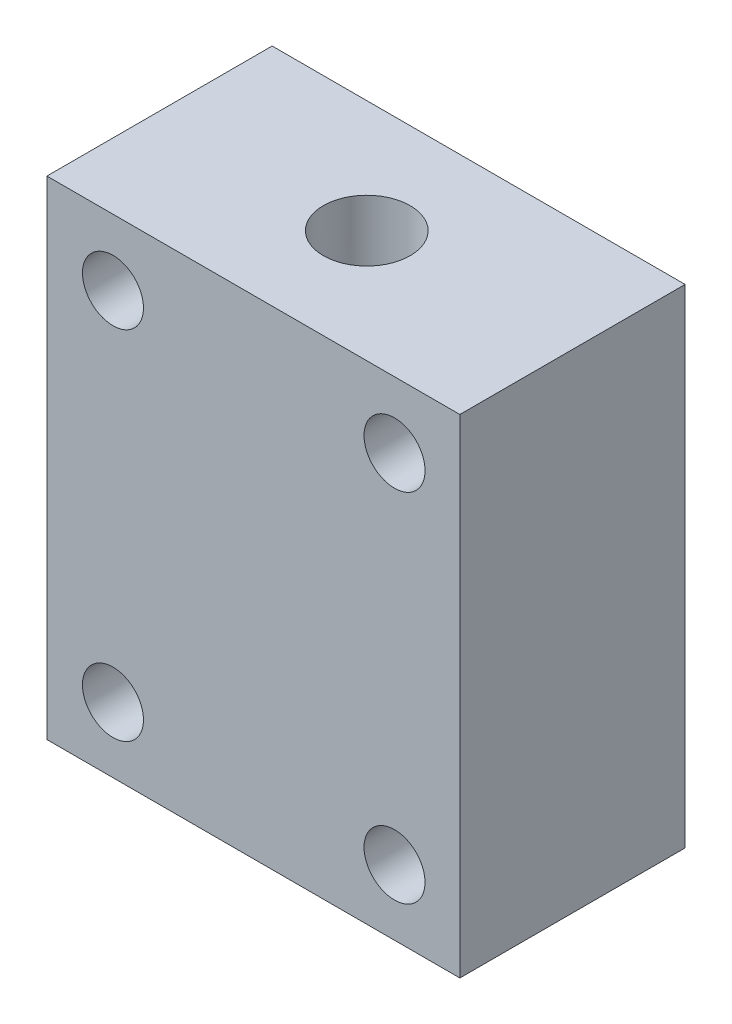
from build123d import *

# Parameters (mm, degrees)
SKETCH1_W                   = 82.55
SKETCH1_H                   = 69.85
BOSS_EXTRUDE1_DEPTH         = 19.05
F_3_8_CLEARANCE_HOLE1_D     = 10.31875
F_3_8_CLEARANCE_HOLE1_DEPTH = 38.1
F_3_8_CLEARANCE_HOLE1_TIP   = 3.100065256
F_3_8_CLEARANCE_HOLE2_D     = 10.31875
F_3_8_CLEARANCE_HOLE2_DEPTH = 38.1
F_3_8_CLEARANCE_HOLE2_TIP   = 3.100065256
CUT_EXTRUDE2_START          = -19.05
SKETCH6_R                   = 7.3421875
CUT_EXTRUDE2_DEPTH          = 28.448
CUT_EXTRUDE4_START          = -19.05
SKETCH7_R                   = 12.7254
CUT_EXTRUDE4_DEPTH          = 2.8194
CUT_EXTRUDE6_START          = -19.05
SKETCH8_R                   = 7.3421875
CUT_EXTRUDE6_DEPTH          = 28.448
CUT_EXTRUDE8_START          = -19.05
SKETCH9_R                   = 12.7254
CUT_EXTRUDE8_DEPTH          = 2.8194
CUT_EXTRUDE10_START         = 41.275
SKETCH10_R                  = 7.3421875
CUT_EXTRUDE10_DEPTH         = 60.452


with BuildPart() as part:
    # Sketch1 → Boss-Extrude1 (new, symmetric)
    with BuildSketch(Plane(origin=(0, 0, 0), x_dir=(0, 1, 0), z_dir=(0, 0, 1))):
        Rectangle(SKETCH1_W, SKETCH1_H)
    extrude(amount=BOSS_EXTRUDE1_DEPTH, both=True)

    # 3/8 Clearance Hole1
    with Locations(Plane(origin=(0, 0, -19.05), x_dir=(-1, 0, 0), z_dir=(0, 0, -1))):
        with Locations((-23.876, -30.226)):
            Hole(F_3_8_CLEARANCE_HOLE1_D / 2, depth=F_3_8_CLEARANCE_HOLE1_DEPTH)
            with Locations((0, 0, -(F_3_8_CLEARANCE_HOLE1_DEPTH + F_3_8_CLEARANCE_HOLE1_TIP / 2))):  # 118° drill point
                Cone(0, F_3_8_CLEARANCE_HOLE1_D / 2, F_3_8_CLEARANCE_HOLE1_TIP, mode=Mode.SUBTRACT)

    # 3/8 Clearance Hole2
    with Locations(Plane(origin=(0, 0, -19.05), x_dir=(-1, 0, 0), z_dir=(0, 0, -1))):
        with Locations((-23.876, 30.099), (23.749, -30.226), (23.749, 30.099)):
            Hole(F_3_8_CLEARANCE_HOLE2_D / 2, depth=F_3_8_CLEARANCE_HOLE2_DEPTH)
            with Locations((0, 0, -(F_3_8_CLEARANCE_HOLE2_DEPTH + F_3_8_CLEARANCE_HOLE2_TIP / 2))):  # 118° drill point
                Cone(0, F_3_8_CLEARANCE_HOLE2_D / 2, F_3_8_CLEARANCE_HOLE2_TIP, mode=Mode.SUBTRACT)

    # Sketch6 → Cut-Extrude2 (cut)
    with BuildSketch(Plane(origin=(0, 0, 0), x_dir=(0, 1, 0), z_dir=(0, 0, 1)).offset(CUT_EXTRUDE2_START)):
        with Locations(Location((-17.653, -0.127, 0), (0, 0, 270))):
            Circle(SKETCH6_R)
    extrude(amount=CUT_EXTRUDE2_DEPTH, mode=Mode.SUBTRACT)

    # Sketch7 → Cut-Extrude4 (cut)
    with BuildSketch(Plane(origin=(0, 0, 0), x_dir=(0, 1, 0), z_dir=(0, 0, 1)).offset(CUT_EXTRUDE4_START)):
        with Locations(Location((-17.653, -0.127, 0), (0, 0, 270))):
            Circle(SKETCH7_R)
    extrude(amount=CUT_EXTRUDE4_DEPTH, mode=Mode.SUBTRACT)

    # Sketch8 → Cut-Extrude6 (cut)
    with BuildSketch(Plane(origin=(0, 0, 0), x_dir=(0, 1, 0), z_dir=(0, 0, 1)).offset(CUT_EXTRUDE6_START)):
        with Locations(Location((17.399, -0.127, 0), (0, 0, 270))):
            Circle(SKETCH8_R)
    extrude(amount=CUT_EXTRUDE6_DEPTH, mode=Mode.SUBTRACT)

    # Sketch9 → Cut-Extrude8 (cut)
    with BuildSketch(Plane(origin=(0, 0, 0), x_dir=(0, 1, 0), z_dir=(0, 0, 1)).offset(CUT_EXTRUDE8_START)):
        with Locations(Location((17.399, -0.127, 0), (0, 0, 270))):
            Circle(SKETCH9_R)
    extrude(amount=CUT_EXTRUDE8_DEPTH, mode=Mode.SUBTRACT)

    # Sketch10 → Cut-Extrude10 (cut)
    with BuildSketch(Plane(origin=(0, 0, 0), x_dir=(-1, 0, 0), z_dir=(0, 1, 0)).offset(CUT_EXTRUDE10_START)):
        with Locations((-0.127, 0)):
            Circle(SKETCH10_R)
    extrude(amount=-CUT_EXTRUDE10_DEPTH, mode=Mode.SUBTRACT)


solid = part.part
